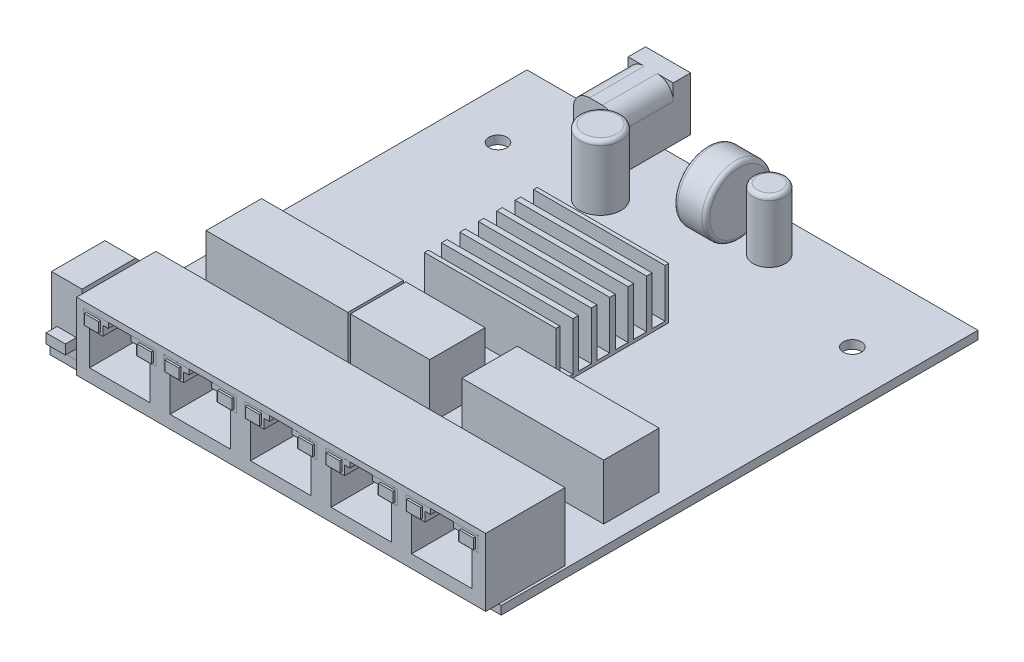
from build123d import *

# Parameters (mm, degrees)
SKETCH1_W                                = 88.9
SKETCH1_H                                = 93.98
EXTRUDE1_DEPTH                           = 1.651
SKETCH2_W                                = 6.0198
SKETCH2_H                                = 13.716
EXTRUDE2_DEPTH                           = 12.7
CHAMFER1_SIZE                            = 3.175
SKETCH3_W                                = 3.81
SKETCH3_H                                = 1.905
EXTRUDE3_DEPTH                           = 2.1844
SKETCH4_W                                = 80.645
SKETCH4_H                                = 15.621
EXTRUDE4_DEPTH                           = 13.335
CUT_EXTRUDE1_DEPTH                       = 11.43
SKETCH8_W                                = 2.794
SKETCH8_H                                = 2.032
EXTRUDE5_DEPTH                           = 0.396875
SKETCH8_3_W                              = 2.794
SKETCH8_3_H                              = 2.032
EXTRUDE13_DEPTH                          = 0.00127
LPATTERN2_COUNT                          = 5
LPATTERN2_PITCH                          = 15.875
SKETCH9_W                                = 27.94
SKETCH9_H                                = 10.922
EXTRUDE6_DEPTH                           = 10.922
SKETCH9_W_2                              = 15.621
EXTRUDE6_2_DEPTH                         = 10.922
EXTRUDE6_3_DEPTH                         = 10.922
SKETCH10_W                               = 25.908
SKETCH10_H                               = 22.225
EXTRUDE7_DEPTH                           = 10.16
SKETCH11_W                               = 2.54
SKETCH11_H                               = 9.525
EXTRUDE8_DEPTH                           = 25.908
LPATTERN1_COUNT                          = 6
LPATTERN1_PITCH                          = 3.6322
SKETCH12_W                               = 8.89
SKETCH12_H                               = 14.224
EXTRUDE9_DEPTH                           = 10.541
EXTRUDE10_DEPTH                          = 10.795
SKETCH15_R                               = 3.175
EXTRUDE11_DEPTH                          = 8.89
SKETCH16_R                               = 0.79375
EXTRUDE12_DEPTH                          = 7.62
FILLET1_R                                = 0.79375
SKETCH17_W                               = 1.786001
SKETCH17_H                               = 1.651
F_9_64_0_14063_DIAMETER_HOLE1_AT_2_COUNT = 2
F_9_64_0_14063_DIAMETER_HOLE1_AT_2_PITCH = 69.85
SKETCH19_R                               = 4.064
EXTRUDE14_DEPTH                          = 12.7
FILLET2_R                                = 0.79375
SKETCH20_R                               = 3.175
EXTRUDE15_DEPTH                          = 12.192
FILLET3_R                                = 0.79375
SKETCH21_R                               = 6.6675
EXTRUDE16_DEPTH                          = 3.175
FILLET4_R                                = 0.79375


with BuildPart() as part:
    # Sketch1 → Extrude1 (new body)
    with BuildSketch(Plane(origin=(0, 0, 0), x_dir=(1, 0, 0), z_dir=(0, 1, 0))):
        with Locations((44.45, -46.99)):
            Rectangle(SKETCH1_W, SKETCH1_H)
    extrude(amount=EXTRUDE1_DEPTH)

    # Sketch17 → 9/64 (0.14063) Diameter Hole1 (revolve, cut)
    with BuildSketch(Plane(origin=(9.525, 1.651, 15.24), x_dir=(0, 0, 1), z_dir=(1, 0, 0))):
        with Locations((0.8930005, 0.8255)):
            Rectangle(SKETCH17_W, SKETCH17_H)
    f_9_64_0_14063_diameter_hole1 = revolve(axis=Axis((9.525, 8.001, 15.24), (0, -1, 0)), mode=Mode.SUBTRACT)

    # 9/64 (0.14063) Diameter Hole1 at 2: 9/64 (0.14063) Diameter Hole1 ×2
    with Locations(*[(i * F_9_64_0_14063_DIAMETER_HOLE1_AT_2_PITCH, 0, 0) for i in range(1, F_9_64_0_14063_DIAMETER_HOLE1_AT_2_COUNT)]):
        add(f_9_64_0_14063_diameter_hole1, mode=Mode.SUBTRACT)


with BuildPart() as body_2:
    # Sketch2 → Extrude2 (new body)
    with BuildSketch(Plane(origin=(0, 1.651, 0), x_dir=(1, 0, 0), z_dir=(0, 1, 0))):
        with Locations((3.2639, -87.122)):
            Rectangle(SKETCH2_W, SKETCH2_H)
    extrude(amount=EXTRUDE2_DEPTH)

    # Chamfer1
    chamfer1_edges = [body_2.edges().sort_by_distance(p)[0] for p in [
        (3.2639, 14.351, 80.264),
    ]]
    chamfer(chamfer1_edges, length=CHAMFER1_SIZE)

    # Sketch3 → Extrude3 (add)
    with BuildSketch(Plane.XY.offset(93.98)):
        with Locations((3.2639, 4.572)):
            Rectangle(SKETCH3_W, SKETCH3_H)
    extrude(amount=EXTRUDE3_DEPTH)


with BuildPart() as body_3:
    # Sketch4 → Extrude4 (new body)
    with BuildSketch(Plane(origin=(0, 1.651, 0), x_dir=(1, 0, 0), z_dir=(0, 1, 0))):
        with Locations((48.0695, -88.7095)):
            Rectangle(SKETCH4_W, SKETCH4_H)
    extrude(amount=EXTRUDE4_DEPTH)

    # Sketch6 → Cut-Extrude1 (cut)
    with BuildSketch(Plane.XY.offset(96.52)):
        Polygon((14.0208, 12.7762), (14.0208, 13.7922), (18.4912, 13.7922), (18.4912, 12.7762), (19.558, 12.7762), (19.558, 10.922), (22.225, 10.922), (22.225, 4.191), (10.287, 4.191), (10.287, 10.922), (12.954, 10.922), (12.954, 12.7762), align=None)
    cut_extrude1 = extrude(amount=-CUT_EXTRUDE1_DEPTH, mode=Mode.SUBTRACT)

    # Sketch8 → Extrude5 (add)
    with BuildSketch(Plane.XY.offset(96.52)):
        with Locations((11.049, 12.3571)):
            Rectangle(SKETCH8_W, SKETCH8_H)
        with Locations((21.463, 12.3571)):
            Rectangle(SKETCH8_W, SKETCH8_H)
    extrude5 = extrude(amount=EXTRUDE5_DEPTH)

    # Sketch8<3> → Extrude13 (add)
    # profile 1 of 2: a face of its own
    with BuildSketch(Plane.XY.offset(96.52)):
        Polygon((12.954, 10.922), (9.144, 10.922), (9.144, 13.7922), (12.954, 13.7922), (14.0208, 13.7922), (14.0208, 12.7762), (12.954, 12.7762), align=None)
        with Locations((11.049, 12.3571)):
            Rectangle(SKETCH8_3_W, SKETCH8_3_H, mode=Mode.SUBTRACT)
    # profile 2 of 2: a face of its own
    with BuildSketch(Plane.XY.offset(96.52)):
        Polygon((19.558, 10.922), (23.368, 10.922), (23.368, 13.7922), (19.558, 13.7922), (18.4912, 13.7922), (18.4912, 12.7762), (19.558, 12.7762), align=None)
        with Locations((21.463, 12.3571)):
            Rectangle(SKETCH8_3_W, SKETCH8_3_H, mode=Mode.SUBTRACT)
    extrude13 = extrude(amount=EXTRUDE13_DEPTH)

    # LPattern2: Cut-Extrude1, Extrude5, Extrude13 ×5
    with Locations(*[(i * LPATTERN2_PITCH, 0, 0) for i in range(1, LPATTERN2_COUNT)]):
        add(cut_extrude1, mode=Mode.SUBTRACT)
        add(extrude5)
        add(extrude13)


with BuildPart() as body_4:
    # Sketch9 → Extrude6 (new body)
    with BuildSketch(Plane(origin=(0, 1.651, 0), x_dir=(1, 0, 0), z_dir=(0, 1, 0))):
        with Locations((20.701, -64.516)):
            Rectangle(SKETCH9_W, SKETCH9_H)
    extrude(amount=EXTRUDE6_DEPTH)


with BuildPart() as body_5:
    # Sketch9 → Extrude6 2 (new body)
    with BuildSketch(Plane(origin=(0, 1.651, 0), x_dir=(1, 0, 0), z_dir=(0, 1, 0))):
        with Locations((42.9895, -64.516)):
            Rectangle(SKETCH9_W_2, SKETCH9_H)
    extrude(amount=EXTRUDE6_2_DEPTH)


with BuildPart() as body_6:
    # Sketch9 → Extrude6 3 (new body)
    with BuildSketch(Plane(origin=(0, 1.651, 0), x_dir=(1, 0, 0), z_dir=(0, 1, 0))):
        with Locations((71.12, -64.516)):
            Rectangle(SKETCH9_W, SKETCH9_H)
    extrude(amount=EXTRUDE6_3_DEPTH)


with BuildPart() as body_7:
    # Sketch10 → Extrude7 (new body)
    with BuildSketch(Plane(origin=(0, 1.651, 0), x_dir=(1, 0, 0), z_dir=(0, 1, 0))):
        with Locations((44.196, -40.3225)):
            Rectangle(SKETCH10_W, SKETCH10_H)
    extrude(amount=EXTRUDE7_DEPTH)

    # Sketch11 → Extrude8 (cut)
    with BuildSketch(Plane(origin=(57.15, 0, 0), x_dir=(0, 0, -1), z_dir=(1, 0, 0))):
        with Locations((-49.37125, 7.0485)):
            Rectangle(SKETCH11_W, SKETCH11_H)
    extrude8 = extrude(amount=-EXTRUDE8_DEPTH, mode=Mode.SUBTRACT)

    # LPattern1: Extrude8 ×6
    with Locations(*[(0, 0, -i * LPATTERN1_PITCH) for i in range(1, LPATTERN1_COUNT)]):
        add(extrude8, mode=Mode.SUBTRACT)


with BuildPart() as body_8:
    # Sketch12 → Extrude9 (new body)
    with BuildSketch(Plane(origin=(0, 1.651, 0), x_dir=(1, 0, 0), z_dir=(0, 1, 0))):
        with Locations((22.733, -2.032)):
            Rectangle(SKETCH12_W, SKETCH12_H)
    extrude(amount=EXTRUDE9_DEPTH)

    # Sketch14 → Extrude10 (cut)
    with BuildSketch(Plane.XY.offset(9.144)):
        with BuildLine():
            Line((21.463, 12.192), (18.288, 12.192))
            Line((18.288, 12.192), (18.288, 9.017))
            ThreePointArc((18.288, 9.017), (19.21793597, 11.26206403), (21.463, 12.192))
        make_face()
        with BuildLine():
            Line((27.178, 9.017), (27.178, 12.192))
            Line((27.178, 12.192), (24.003, 12.192))
            ThreePointArc((24.003, 12.192), (26.24806403, 11.26206403), (27.178, 9.017))
        make_face()
    extrude(amount=-EXTRUDE10_DEPTH, mode=Mode.SUBTRACT)

    # Sketch15 → Extrude11 (cut)
    with BuildSketch(Plane(origin=(0, 0, -5.08), x_dir=(-1, 0, 0), z_dir=(0, 0, -1))):
        with Locations((-22.733, 8.001)):
            Circle(SKETCH15_R)
    extrude(amount=-EXTRUDE11_DEPTH, mode=Mode.SUBTRACT)

    # Sketch16 → Extrude12 (add)
    with BuildSketch(Plane(origin=(0, 0, 3.81), x_dir=(-1, 0, 0), z_dir=(0, 0, -1))):
        with Locations(Location((-22.733, 8.001, 0), (0, 0, 180))):
            Circle(SKETCH16_R)
    extrude(amount=EXTRUDE12_DEPTH)

    # Fillet1
    fillet1_edges = [body_8.edges().sort_by_distance(p)[0] for p in [
        (21.93925, 8.001, -3.81),
    ]]
    fillet(fillet1_edges, radius=FILLET1_R)


with BuildPart() as body_9:
    # Sketch19 → Extrude14 (new body)
    with BuildSketch(Plane(origin=(0, 1.651, 0), x_dir=(1, 0, 0), z_dir=(0, 1, 0))):
        with Locations(Location((29.21, -14.732, 0), (0, 0, 270))):
            Circle(SKETCH19_R)
    extrude(amount=EXTRUDE14_DEPTH)

    # Fillet2
    fillet2_edges = [body_9.edges().sort_by_distance(p)[0] for p in [
        (29.21, 14.351, 10.668),
    ]]
    fillet(fillet2_edges, radius=FILLET2_R)


with BuildPart() as body_10:
    # Sketch20 → Extrude15 (new body)
    with BuildSketch(Plane(origin=(0, 1.651, 0), x_dir=(1, 0, 0), z_dir=(0, 1, 0))):
        with Locations(Location((55.372, -7.62, 0), (0, 0, 90))):
            Circle(SKETCH20_R)
    extrude(amount=EXTRUDE15_DEPTH)

    # Fillet3
    fillet3_edges = [body_10.edges().sort_by_distance(p)[0] for p in [
        (55.372, 13.843, 10.795),
    ]]
    fillet(fillet3_edges, radius=FILLET3_R)


with BuildPart() as body_11:
    # Sketch21 → Extrude16 (new, symmetric)
    with BuildSketch(Plane.ZY.offset(-46.99)):
        with Locations((8.255, 8.3185)):
            Circle(SKETCH21_R)
    extrude(amount=EXTRUDE16_DEPTH, both=True)

    # Fillet4
    fillet4_edges = [body_11.edges().sort_by_distance(p)[0] for p in [
        (50.165, 8.3185, 1.5875),
        (43.815, 8.3185, 1.5875),
    ]]
    fillet(fillet4_edges, radius=FILLET4_R)


solid = Compound([part.part, body_2.part, body_3.part, body_4.part, body_5.part, body_6.part, body_7.part, body_8.part, body_9.part, body_10.part, body_11.part])
